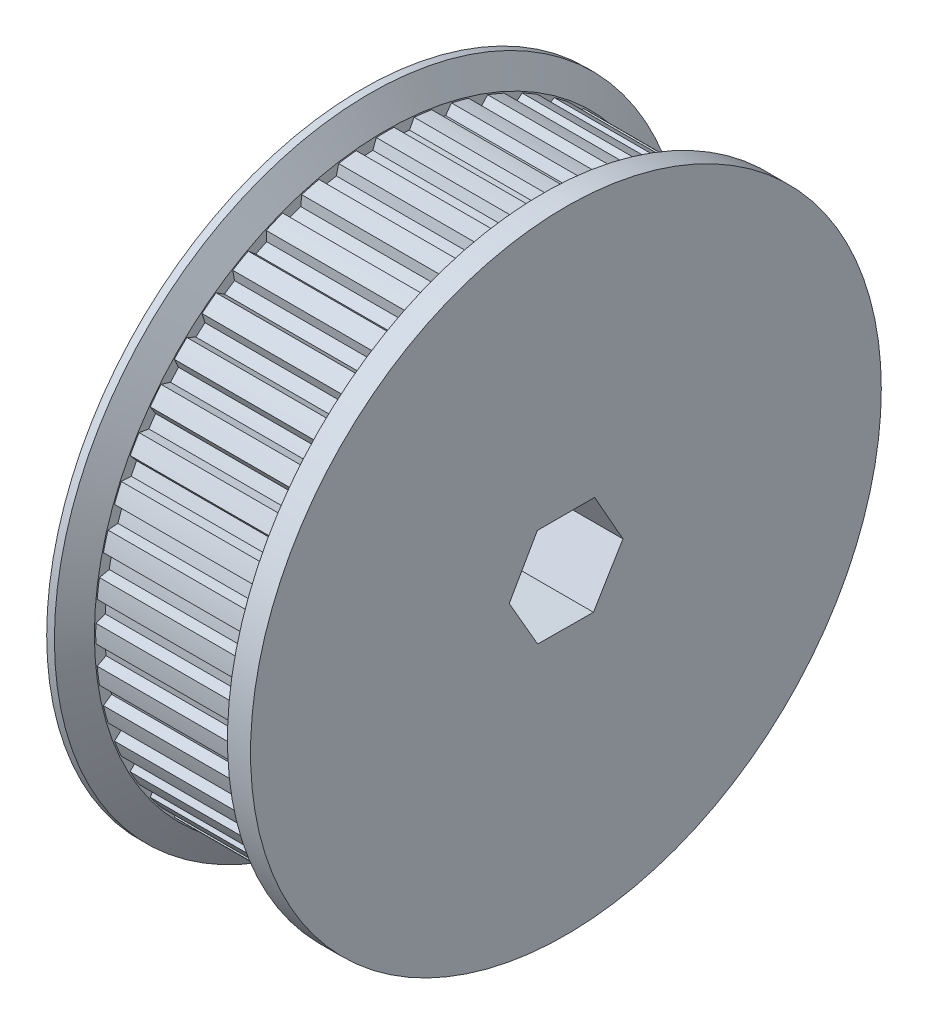
from build123d import *

# Parameters (mm, degrees)
SKETCH1_W                = 20.5
SKETCH1_H                = 37.625
CUT_EXTRUDE1_DEPTH       = 58.022199624
CUT_EXTRUDE2_DEPTH       = 58.022199624
CUT_EXTRUDE3_DEPTH       = 58.022199624
CUT_EXTRUDE4_DEPTH       = 58.022199624
CUT_EXTRUDE5_DEPTH       = 58.022199624
CUT_EXTRUDE6_DEPTH       = 58.022199624
CUT_EXTRUDE7_DEPTH       = 58.022199624
CUT_EXTRUDE8_DEPTH       = 58.022199624
CUT_EXTRUDE9_DEPTH       = 58.022199624
CUT_EXTRUDE10_DEPTH      = 58.022199624
CUT_EXTRUDE11_DEPTH      = 58.022199624
CUT_EXTRUDE12_DEPTH      = 58.022199624
CUT_EXTRUDE13_DEPTH      = 58.022199624
CUT_EXTRUDE14_DEPTH      = 58.022199624
CUT_EXTRUDE15_DEPTH      = 58.022199624
CUT_EXTRUDE16_DEPTH      = 58.022199624
CUT_EXTRUDE17_DEPTH      = 58.022199624
CUT_EXTRUDE18_DEPTH      = 58.022199624
CUT_EXTRUDE19_DEPTH      = 58.022199624
CUT_EXTRUDE20_DEPTH      = 58.022199624
CUT_EXTRUDE21_DEPTH      = 58.022199624
CUT_EXTRUDE22_DEPTH      = 58.022199624
CUT_EXTRUDE23_DEPTH      = 58.022199624
CUT_EXTRUDE24_DEPTH      = 58.022199624
CUT_EXTRUDE25_DEPTH      = 58.022199624
CUT_EXTRUDE26_DEPTH      = 58.022199624
CUT_EXTRUDE27_DEPTH      = 58.022199624
CUT_EXTRUDE28_DEPTH      = 58.022199624
CUT_EXTRUDE29_DEPTH      = 58.022199624
CUT_EXTRUDE30_DEPTH      = 58.022199624
CUT_EXTRUDE31_DEPTH      = 58.022199624
CUT_EXTRUDE32_DEPTH      = 58.022199624
CUT_EXTRUDE33_DEPTH      = 58.022199624
CUT_EXTRUDE34_DEPTH      = 58.022199624
CUT_EXTRUDE35_DEPTH      = 58.022199624
CUT_EXTRUDE36_DEPTH      = 58.022199624
CUT_EXTRUDE37_DEPTH      = 58.022199624
CUT_EXTRUDE38_DEPTH      = 58.022199624
CUT_EXTRUDE39_DEPTH      = 58.022199624
CUT_EXTRUDE40_DEPTH      = 58.022199624
CUT_EXTRUDE41_DEPTH      = 58.022199624
CUT_EXTRUDE42_DEPTH      = 58.022199624
CUT_EXTRUDE43_DEPTH      = 58.022199624
CUT_EXTRUDE44_DEPTH      = 58.022199624
CUT_EXTRUDE45_DEPTH      = 58.022199624
CUT_EXTRUDE46_DEPTH      = 58.022199624
CUT_EXTRUDE47_DEPTH      = 58.022199624
CUT_EXTRUDE48_DEPTH      = 58.022199624
SKETCH58_R               = 41
BOSS_EXTRUDE2_DEPTH      = 3
BOSS_EXTRUDE4_START      = 3
SKETCH60_R               = 41
BOSS_EXTRUDE4_DEPTH      = 3
CHAMFER1_SIZE            = 3.2
CHAMFER1_SIZE2           = 2
CUT_EXTRUDE49_DEPTH      = 63.563967266
CUT_EXTRUDE49_DEPTH_BACK = 63.563967266


with BuildPart() as part:
    # Sketch1 → Revolve1 (revolve)
    with BuildSketch(Plane(origin=(0, 0, 0), x_dir=(-1, 0, 0), z_dir=(0, 0, -1)), mode=Mode.PRIVATE) as revolve1_sk:
        with Locations((-10.25, 18.8125)):
            Rectangle(SKETCH1_W, SKETCH1_H)
    revolve(revolve1_sk.sketch.rotate(Axis((20.5, 0, 0), (-1, 0, 0)), 270), axis=Axis((20.5, 0, 0), (-1, 0, 0)))

    # Sketch2 → Cut-Extrude1 (cut, through all)
    with BuildSketch(Plane.ZY):
        with BuildLine():
            Line((-37.60720906, 1.156914747), (-36.389842333, 1.6))
            ThreePointArc((-36.389842333, 1.6), (-36.347011279, 2.382308982), (-36.287364095, 3.163515777))
            Line((-36.287364095, 3.163515777), (-37.43648185, 3.761708617))
            ThreePointArc((-37.43648185, 3.761708617), (-37.544441987, 2.460792737), (-37.60720906, 1.156914747))
        make_face()
    extrude(amount=-CUT_EXTRUDE1_DEPTH, mode=Mode.SUBTRACT)

    # Sketch3 → Cut-Extrude2 (cut, through all)
    with BuildSketch(Plane.ZY):
        with BuildLine():
            Line((-37.134466496, 6.05574298), (-35.869680279, 6.336139333))
            ThreePointArc((-35.869680279, 6.336139333), (-35.725103839, 7.106164979), (-35.563998996, 7.872902922))
            Line((-35.563998996, 7.872902922), (-36.625206056, 8.615968105))
            ThreePointArc((-36.625206056, 8.615968105), (-36.902046175, 7.340273366), (-37.134466496, 6.05574298))
        make_face()
    extrude(amount=-CUT_EXTRUDE2_DEPTH, mode=Mode.SUBTRACT)

    # Sketch4 → Cut-Extrude3 (cut, through all)
    with BuildSketch(Plane.ZY):
        with BuildLine():
            Line((-36.026342915, 10.850955771), (-34.735778052, 10.963865566))
            ThreePointArc((-34.735778052, 10.963865566), (-34.491929967, 11.708432524), (-34.232124014, 12.447582515))
            Line((-34.232124014, 12.447582515), (-35.187262832, 13.322805989))
            ThreePointArc((-35.187262832, 13.322805989), (-35.628246122, 12.094159882), (-36.026342915, 10.850955771))
        make_face()
    extrude(amount=-CUT_EXTRUDE3_DEPTH, mode=Mode.SUBTRACT)

    # Sketch5 → Cut-Extrude4 (cut, through all)
    with BuildSketch(Plane.ZY):
        with BuildLine():
            Line((-34.301798619, 15.4605057), (-33.007537031, 15.403997019))
            ThreePointArc((-33.007537031, 15.403997019), (-32.66858961, 16.110365541), (-32.3145279, 16.80928052))
            Line((-32.3145279, 16.80928052), (-33.147255785, 17.801686969))
            ThreePointArc((-33.147255785, 17.801686969), (-33.7448369, 16.641111969), (-34.301798619, 15.4605057))
        make_face()
    extrude(amount=-CUT_EXTRUDE4_DEPTH, mode=Mode.SUBTRACT)

    # Sketch6 → Cut-Extrude5 (cut, through all)
    with BuildSketch(Plane.ZY):
        with BuildLine():
            Line((-31.990341038, 19.805522091), (-30.7145279, 19.580561812))
            ThreePointArc((-30.7145279, 19.580561812), (-30.286280628, 20.236645738), (-29.844021254, 20.883367075))
            Line((-29.844021254, 20.883367075), (-30.540090001, 21.975976149))
            ThreePointArc((-30.540090001, 21.975976149), (-31.284044163, 20.903330017), (-31.990341038, 19.805522091))
        make_face()
    extrude(amount=-CUT_EXTRUDE5_DEPTH, mode=Mode.SUBTRACT)

    # Sketch7 → Cut-Extrude6 (cut, through all)
    with BuildSketch(Plane.ZY):
        with BuildLine():
            Line((-29.131519852, 23.811660507), (-27.895984681, 23.422097764))
            ThreePointArc((-27.895984681, 23.422097764), (-27.385764987, 24.016671315), (-26.86287513, 24.60013343))
            Line((-26.86287513, 24.60013343), (-27.410374811, 25.774250285))
            ThreePointArc((-27.410374811, 25.774250285), (-28.287972756, 24.807886293), (-29.131519852, 23.811660507))
        make_face()
    extrude(amount=-CUT_EXTRUDE6_DEPTH, mode=Mode.SUBTRACT)

    # Sketch8 → Cut-Extrude7 (cut, through all)
    with BuildSketch(Plane.ZY):
        with BuildLine():
            Line((-25.774250285, 27.410374811), (-24.60013343, 26.86287513))
            ThreePointArc((-24.60013343, 26.86287513), (-24.016671315, 27.385764987), (-23.422097764, 27.895984681))
            Line((-23.422097764, 27.895984681), (-23.811660507, 29.131519852))
            ThreePointArc((-23.811660507, 29.131519852), (-24.807886293, 28.287972756), (-25.774250285, 27.410374811))
        make_face()
    extrude(amount=-CUT_EXTRUDE7_DEPTH, mode=Mode.SUBTRACT)

    # Sketch9 → Cut-Extrude8 (cut, through all)
    with BuildSketch(Plane.ZY):
        with BuildLine():
            Line((-21.975976149, 30.540090001), (-20.883367075, 29.844021254))
            ThreePointArc((-20.883367075, 29.844021254), (-20.236645738, 30.286280628), (-19.580561812, 30.7145279))
            Line((-19.580561812, 30.7145279), (-19.805522091, 31.990341038))
            ThreePointArc((-19.805522091, 31.990341038), (-20.903330017, 31.284044163), (-21.975976149, 30.540090001))
        make_face()
    extrude(amount=-CUT_EXTRUDE8_DEPTH, mode=Mode.SUBTRACT)

    # Sketch10 → Cut-Extrude9 (cut, through all)
    with BuildSketch(Plane.ZY):
        with BuildLine():
            Line((-17.801686969, 33.147255785), (-16.80928052, 32.3145279))
            ThreePointArc((-16.80928052, 32.3145279), (-16.110365541, 32.66858961), (-15.403997019, 33.007537031))
            Line((-15.403997019, 33.007537031), (-15.4605057, 34.301798619))
            ThreePointArc((-15.4605057, 34.301798619), (-16.641111969, 33.7448369), (-17.801686969, 33.147255785))
        make_face()
    extrude(amount=-CUT_EXTRUDE9_DEPTH, mode=Mode.SUBTRACT)

    # Sketch11 → Cut-Extrude10 (cut, through all)
    with BuildSketch(Plane.ZY):
        with BuildLine():
            Line((-13.322805989, 35.187262832), (-12.447582515, 34.232124014))
            ThreePointArc((-12.447582515, 34.232124014), (-11.708432524, 34.491929967), (-10.963865566, 34.735778052))
            Line((-10.963865566, 34.735778052), (-10.850955771, 36.026342915))
            ThreePointArc((-10.850955771, 36.026342915), (-12.094159882, 35.628246122), (-13.322805989, 35.187262832))
        make_face()
    extrude(amount=-CUT_EXTRUDE10_DEPTH, mode=Mode.SUBTRACT)

    # Sketch12 → Cut-Extrude11 (cut, through all)
    with BuildSketch(Plane.ZY):
        with BuildLine():
            Line((-8.615968105, 36.625206056), (-7.872902922, 35.563998996))
            ThreePointArc((-7.872902922, 35.563998996), (-7.106164979, 35.725103839), (-6.336139333, 35.869680279))
            Line((-6.336139333, 35.869680279), (-6.05574298, 37.134466496))
            ThreePointArc((-6.05574298, 37.134466496), (-7.340273366, 36.902046175), (-8.615968105, 36.625206056))
        make_face()
    extrude(amount=-CUT_EXTRUDE11_DEPTH, mode=Mode.SUBTRACT)

    # Sketch13 → Cut-Extrude12 (cut, through all)
    with BuildSketch(Plane.ZY):
        with BuildLine():
            Line((-3.761708617, 37.43648185), (-3.163515777, 36.287364095))
            ThreePointArc((-3.163515777, 36.287364095), (-2.382308982, 36.347011279), (-1.6, 36.389842333))
            Line((-1.6, 36.389842333), (-1.156914747, 37.60720906))
            ThreePointArc((-1.156914747, 37.60720906), (-2.460792737, 37.544441987), (-3.761708617, 37.43648185))
        make_face()
    extrude(amount=-CUT_EXTRUDE12_DEPTH, mode=Mode.SUBTRACT)

    # Sketch14 → Cut-Extrude13 (cut, through all)
    with BuildSketch(Plane.ZY):
        with BuildLine():
            Line((1.156914747, 37.60720906), (1.6, 36.389842333))
            ThreePointArc((1.6, 36.389842333), (2.382308982, 36.347011279), (3.163515777, 36.287364095))
            Line((3.163515777, 36.287364095), (3.761708617, 37.43648185))
            ThreePointArc((3.761708617, 37.43648185), (2.460792737, 37.544441987), (1.156914747, 37.60720906))
        make_face()
    extrude(amount=-CUT_EXTRUDE13_DEPTH, mode=Mode.SUBTRACT)

    # Sketch15 → Cut-Extrude14 (cut, through all)
    with BuildSketch(Plane.ZY):
        with BuildLine():
            Line((6.05574298, 37.134466496), (6.336139333, 35.869680279))
            ThreePointArc((6.336139333, 35.869680279), (7.106164979, 35.725103839), (7.872902922, 35.563998996))
            Line((7.872902922, 35.563998996), (8.615968105, 36.625206056))
            ThreePointArc((8.615968105, 36.625206056), (7.340273366, 36.902046175), (6.05574298, 37.134466496))
        make_face()
    extrude(amount=-CUT_EXTRUDE14_DEPTH, mode=Mode.SUBTRACT)

    # Sketch16 → Cut-Extrude15 (cut, through all)
    with BuildSketch(Plane.ZY):
        with BuildLine():
            Line((10.850955771, 36.026342915), (10.963865566, 34.735778052))
            ThreePointArc((10.963865566, 34.735778052), (11.708432524, 34.491929967), (12.447582515, 34.232124014))
            Line((12.447582515, 34.232124014), (13.322805989, 35.187262832))
            ThreePointArc((13.322805989, 35.187262832), (12.094159882, 35.628246122), (10.850955771, 36.026342915))
        make_face()
    extrude(amount=-CUT_EXTRUDE15_DEPTH, mode=Mode.SUBTRACT)

    # Sketch17 → Cut-Extrude16 (cut, through all)
    with BuildSketch(Plane.ZY):
        with BuildLine():
            Line((15.4605057, 34.301798619), (15.403997019, 33.007537031))
            ThreePointArc((15.403997019, 33.007537031), (16.110365541, 32.66858961), (16.80928052, 32.3145279))
            Line((16.80928052, 32.3145279), (17.801686969, 33.147255785))
            ThreePointArc((17.801686969, 33.147255785), (16.641111969, 33.7448369), (15.4605057, 34.301798619))
        make_face()
    extrude(amount=-CUT_EXTRUDE16_DEPTH, mode=Mode.SUBTRACT)

    # Sketch18 → Cut-Extrude17 (cut, through all)
    with BuildSketch(Plane.ZY):
        with BuildLine():
            Line((19.805522091, 31.990341038), (19.580561812, 30.7145279))
            ThreePointArc((19.580561812, 30.7145279), (20.236645738, 30.286280628), (20.883367075, 29.844021254))
            Line((20.883367075, 29.844021254), (21.975976149, 30.540090001))
            ThreePointArc((21.975976149, 30.540090001), (20.903330017, 31.284044163), (19.805522091, 31.990341038))
        make_face()
    extrude(amount=-CUT_EXTRUDE17_DEPTH, mode=Mode.SUBTRACT)

    # Sketch19 → Cut-Extrude18 (cut, through all)
    with BuildSketch(Plane.ZY):
        with BuildLine():
            Line((23.811660507, 29.131519852), (23.422097764, 27.895984681))
            ThreePointArc((23.422097764, 27.895984681), (24.016671315, 27.385764987), (24.60013343, 26.86287513))
            Line((24.60013343, 26.86287513), (25.774250285, 27.410374811))
            ThreePointArc((25.774250285, 27.410374811), (24.807886293, 28.287972756), (23.811660507, 29.131519852))
        make_face()
    extrude(amount=-CUT_EXTRUDE18_DEPTH, mode=Mode.SUBTRACT)

    # Sketch20 → Cut-Extrude19 (cut, through all)
    with BuildSketch(Plane.ZY):
        with BuildLine():
            Line((27.410374811, 25.774250285), (26.86287513, 24.60013343))
            ThreePointArc((26.86287513, 24.60013343), (27.385764987, 24.016671315), (27.895984681, 23.422097764))
            Line((27.895984681, 23.422097764), (29.131519852, 23.811660507))
            ThreePointArc((29.131519852, 23.811660507), (28.287972756, 24.807886293), (27.410374811, 25.774250285))
        make_face()
    extrude(amount=-CUT_EXTRUDE19_DEPTH, mode=Mode.SUBTRACT)

    # Sketch21 → Cut-Extrude20 (cut, through all)
    with BuildSketch(Plane.ZY):
        with BuildLine():
            Line((30.540090001, 21.975976149), (29.844021254, 20.883367075))
            ThreePointArc((29.844021254, 20.883367075), (30.286280628, 20.236645738), (30.7145279, 19.580561812))
            Line((30.7145279, 19.580561812), (31.990341038, 19.805522091))
            ThreePointArc((31.990341038, 19.805522091), (31.284044163, 20.903330017), (30.540090001, 21.975976149))
        make_face()
    extrude(amount=-CUT_EXTRUDE20_DEPTH, mode=Mode.SUBTRACT)

    # Sketch22 → Cut-Extrude21 (cut, through all)
    with BuildSketch(Plane.ZY):
        with BuildLine():
            Line((33.147255785, 17.801686969), (32.3145279, 16.80928052))
            ThreePointArc((32.3145279, 16.80928052), (32.66858961, 16.110365541), (33.007537031, 15.403997019))
            Line((33.007537031, 15.403997019), (34.301798619, 15.4605057))
            ThreePointArc((34.301798619, 15.4605057), (33.7448369, 16.641111969), (33.147255785, 17.801686969))
        make_face()
    extrude(amount=-CUT_EXTRUDE21_DEPTH, mode=Mode.SUBTRACT)

    # Sketch23 → Cut-Extrude22 (cut, through all)
    with BuildSketch(Plane.ZY):
        with BuildLine():
            Line((35.187262832, 13.322805989), (34.232124014, 12.447582515))
            ThreePointArc((34.232124014, 12.447582515), (34.491929967, 11.708432524), (34.735778052, 10.963865566))
            Line((34.735778052, 10.963865566), (36.026342915, 10.850955771))
            ThreePointArc((36.026342915, 10.850955771), (35.628246122, 12.094159882), (35.187262832, 13.322805989))
        make_face()
    extrude(amount=-CUT_EXTRUDE22_DEPTH, mode=Mode.SUBTRACT)

    # Sketch24 → Cut-Extrude23 (cut, through all)
    with BuildSketch(Plane.ZY):
        with BuildLine():
            Line((36.625206056, 8.615968105), (35.563998996, 7.872902922))
            ThreePointArc((35.563998996, 7.872902922), (35.725103839, 7.106164979), (35.869680279, 6.336139333))
            Line((35.869680279, 6.336139333), (37.134466496, 6.05574298))
            ThreePointArc((37.134466496, 6.05574298), (36.902046175, 7.340273366), (36.625206056, 8.615968105))
        make_face()
    extrude(amount=-CUT_EXTRUDE23_DEPTH, mode=Mode.SUBTRACT)

    # Sketch25 → Cut-Extrude24 (cut, through all)
    with BuildSketch(Plane.ZY):
        with BuildLine():
            Line((37.43648185, 3.761708617), (36.287364095, 3.163515777))
            ThreePointArc((36.287364095, 3.163515777), (36.347011279, 2.382308982), (36.389842333, 1.6))
            Line((36.389842333, 1.6), (37.60720906, 1.156914747))
            ThreePointArc((37.60720906, 1.156914747), (37.544441987, 2.460792737), (37.43648185, 3.761708617))
        make_face()
    extrude(amount=-CUT_EXTRUDE24_DEPTH, mode=Mode.SUBTRACT)

    # Sketch26 → Cut-Extrude25 (cut, through all)
    with BuildSketch(Plane.ZY):
        with BuildLine():
            Line((37.60720906, -1.156914747), (36.389842333, -1.6))
            ThreePointArc((36.389842333, -1.6), (36.347011279, -2.382308982), (36.287364095, -3.163515777))
            Line((36.287364095, -3.163515777), (37.43648185, -3.761708617))
            ThreePointArc((37.43648185, -3.761708617), (37.544441987, -2.460792737), (37.60720906, -1.156914747))
        make_face()
    extrude(amount=-CUT_EXTRUDE25_DEPTH, mode=Mode.SUBTRACT)

    # Sketch27 → Cut-Extrude26 (cut, through all)
    with BuildSketch(Plane.ZY):
        with BuildLine():
            Line((37.134466496, -6.05574298), (35.869680279, -6.336139333))
            ThreePointArc((35.869680279, -6.336139333), (35.725103839, -7.106164979), (35.563998996, -7.872902922))
            Line((35.563998996, -7.872902922), (36.625206056, -8.615968105))
            ThreePointArc((36.625206056, -8.615968105), (36.902046175, -7.340273366), (37.134466496, -6.05574298))
        make_face()
    extrude(amount=-CUT_EXTRUDE26_DEPTH, mode=Mode.SUBTRACT)

    # Sketch28 → Cut-Extrude27 (cut, through all)
    with BuildSketch(Plane.ZY):
        with BuildLine():
            Line((36.026342915, -10.850955771), (34.735778052, -10.963865566))
            ThreePointArc((34.735778052, -10.963865566), (34.491929967, -11.708432524), (34.232124014, -12.447582515))
            Line((34.232124014, -12.447582515), (35.187262832, -13.322805989))
            ThreePointArc((35.187262832, -13.322805989), (35.628246122, -12.094159882), (36.026342915, -10.850955771))
        make_face()
    extrude(amount=-CUT_EXTRUDE27_DEPTH, mode=Mode.SUBTRACT)

    # Sketch29 → Cut-Extrude28 (cut, through all)
    with BuildSketch(Plane.ZY):
        with BuildLine():
            Line((34.301798619, -15.4605057), (33.007537031, -15.403997019))
            ThreePointArc((33.007537031, -15.403997019), (32.66858961, -16.110365541), (32.3145279, -16.80928052))
            Line((32.3145279, -16.80928052), (33.147255785, -17.801686969))
            ThreePointArc((33.147255785, -17.801686969), (33.7448369, -16.641111969), (34.301798619, -15.4605057))
        make_face()
    extrude(amount=-CUT_EXTRUDE28_DEPTH, mode=Mode.SUBTRACT)

    # Sketch30 → Cut-Extrude29 (cut, through all)
    with BuildSketch(Plane.ZY):
        with BuildLine():
            Line((31.990341038, -19.805522091), (30.7145279, -19.580561812))
            ThreePointArc((30.7145279, -19.580561812), (30.286280628, -20.236645738), (29.844021254, -20.883367075))
            Line((29.844021254, -20.883367075), (30.540090001, -21.975976149))
            ThreePointArc((30.540090001, -21.975976149), (31.284044163, -20.903330017), (31.990341038, -19.805522091))
        make_face()
    extrude(amount=-CUT_EXTRUDE29_DEPTH, mode=Mode.SUBTRACT)

    # Sketch31 → Cut-Extrude30 (cut, through all)
    with BuildSketch(Plane.ZY):
        with BuildLine():
            Line((29.131519852, -23.811660507), (27.895984681, -23.422097764))
            ThreePointArc((27.895984681, -23.422097764), (27.385764987, -24.016671315), (26.86287513, -24.60013343))
            Line((26.86287513, -24.60013343), (27.410374811, -25.774250285))
            ThreePointArc((27.410374811, -25.774250285), (28.287972756, -24.807886293), (29.131519852, -23.811660507))
        make_face()
    extrude(amount=-CUT_EXTRUDE30_DEPTH, mode=Mode.SUBTRACT)

    # Sketch32 → Cut-Extrude31 (cut, through all)
    with BuildSketch(Plane.ZY):
        with BuildLine():
            Line((25.774250285, -27.410374811), (24.60013343, -26.86287513))
            ThreePointArc((24.60013343, -26.86287513), (24.016671315, -27.385764987), (23.422097764, -27.895984681))
            Line((23.422097764, -27.895984681), (23.811660507, -29.131519852))
            ThreePointArc((23.811660507, -29.131519852), (24.807886293, -28.287972756), (25.774250285, -27.410374811))
        make_face()
    extrude(amount=-CUT_EXTRUDE31_DEPTH, mode=Mode.SUBTRACT)

    # Sketch33 → Cut-Extrude32 (cut, through all)
    with BuildSketch(Plane.ZY):
        with BuildLine():
            Line((21.975976149, -30.540090001), (20.883367075, -29.844021254))
            ThreePointArc((20.883367075, -29.844021254), (20.236645738, -30.286280628), (19.580561812, -30.7145279))
            Line((19.580561812, -30.7145279), (19.805522091, -31.990341038))
            ThreePointArc((19.805522091, -31.990341038), (20.903330017, -31.284044163), (21.975976149, -30.540090001))
        make_face()
    extrude(amount=-CUT_EXTRUDE32_DEPTH, mode=Mode.SUBTRACT)

    # Sketch34 → Cut-Extrude33 (cut, through all)
    with BuildSketch(Plane.ZY):
        with BuildLine():
            Line((17.801686969, -33.147255785), (16.80928052, -32.3145279))
            ThreePointArc((16.80928052, -32.3145279), (16.110365541, -32.66858961), (15.403997019, -33.007537031))
            Line((15.403997019, -33.007537031), (15.4605057, -34.301798619))
            ThreePointArc((15.4605057, -34.301798619), (16.641111969, -33.7448369), (17.801686969, -33.147255785))
        make_face()
    extrude(amount=-CUT_EXTRUDE33_DEPTH, mode=Mode.SUBTRACT)

    # Sketch35 → Cut-Extrude34 (cut, through all)
    with BuildSketch(Plane.ZY):
        with BuildLine():
            Line((13.322805989, -35.187262832), (12.447582515, -34.232124014))
            ThreePointArc((12.447582515, -34.232124014), (11.708432524, -34.491929967), (10.963865566, -34.735778052))
            Line((10.963865566, -34.735778052), (10.850955771, -36.026342915))
            ThreePointArc((10.850955771, -36.026342915), (12.094159882, -35.628246122), (13.322805989, -35.187262832))
        make_face()
    extrude(amount=-CUT_EXTRUDE34_DEPTH, mode=Mode.SUBTRACT)

    # Sketch36 → Cut-Extrude35 (cut, through all)
    with BuildSketch(Plane.ZY):
        with BuildLine():
            Line((8.615968105, -36.625206056), (7.872902922, -35.563998996))
            ThreePointArc((7.872902922, -35.563998996), (7.106164979, -35.725103839), (6.336139333, -35.869680279))
            Line((6.336139333, -35.869680279), (6.05574298, -37.134466496))
            ThreePointArc((6.05574298, -37.134466496), (7.340273366, -36.902046175), (8.615968105, -36.625206056))
        make_face()
    extrude(amount=-CUT_EXTRUDE35_DEPTH, mode=Mode.SUBTRACT)

    # Sketch37 → Cut-Extrude36 (cut, through all)
    with BuildSketch(Plane.ZY):
        with BuildLine():
            Line((3.761708617, -37.43648185), (3.163515777, -36.287364095))
            ThreePointArc((3.163515777, -36.287364095), (2.382308982, -36.347011279), (1.6, -36.389842333))
            Line((1.6, -36.389842333), (1.156914747, -37.60720906))
            ThreePointArc((1.156914747, -37.60720906), (2.460792737, -37.544441987), (3.761708617, -37.43648185))
        make_face()
    extrude(amount=-CUT_EXTRUDE36_DEPTH, mode=Mode.SUBTRACT)

    # Sketch38 → Cut-Extrude37 (cut, through all)
    with BuildSketch(Plane.ZY):
        with BuildLine():
            Line((-1.156914747, -37.60720906), (-1.6, -36.389842333))
            ThreePointArc((-1.6, -36.389842333), (-2.382308982, -36.347011279), (-3.163515777, -36.287364095))
            Line((-3.163515777, -36.287364095), (-3.761708617, -37.43648185))
            ThreePointArc((-3.761708617, -37.43648185), (-2.460792737, -37.544441987), (-1.156914747, -37.60720906))
        make_face()
    extrude(amount=-CUT_EXTRUDE37_DEPTH, mode=Mode.SUBTRACT)

    # Sketch39 → Cut-Extrude38 (cut, through all)
    with BuildSketch(Plane.ZY):
        with BuildLine():
            Line((-6.05574298, -37.134466496), (-6.336139333, -35.869680279))
            ThreePointArc((-6.336139333, -35.869680279), (-7.106164979, -35.725103839), (-7.872902922, -35.563998996))
            Line((-7.872902922, -35.563998996), (-8.615968105, -36.625206056))
            ThreePointArc((-8.615968105, -36.625206056), (-7.340273366, -36.902046175), (-6.05574298, -37.134466496))
        make_face()
    extrude(amount=-CUT_EXTRUDE38_DEPTH, mode=Mode.SUBTRACT)

    # Sketch40 → Cut-Extrude39 (cut, through all)
    with BuildSketch(Plane.ZY):
        with BuildLine():
            Line((-10.850955771, -36.026342915), (-10.963865566, -34.735778052))
            ThreePointArc((-10.963865566, -34.735778052), (-11.708432524, -34.491929967), (-12.447582515, -34.232124014))
            Line((-12.447582515, -34.232124014), (-13.322805989, -35.187262832))
            ThreePointArc((-13.322805989, -35.187262832), (-12.094159882, -35.628246122), (-10.850955771, -36.026342915))
        make_face()
    extrude(amount=-CUT_EXTRUDE39_DEPTH, mode=Mode.SUBTRACT)

    # Sketch41 → Cut-Extrude40 (cut, through all)
    with BuildSketch(Plane.ZY):
        with BuildLine():
            Line((-15.4605057, -34.301798619), (-15.403997019, -33.007537031))
            ThreePointArc((-15.403997019, -33.007537031), (-16.110365541, -32.66858961), (-16.80928052, -32.3145279))
            Line((-16.80928052, -32.3145279), (-17.801686969, -33.147255785))
            ThreePointArc((-17.801686969, -33.147255785), (-16.641111969, -33.7448369), (-15.4605057, -34.301798619))
        make_face()
    extrude(amount=-CUT_EXTRUDE40_DEPTH, mode=Mode.SUBTRACT)

    # Sketch42 → Cut-Extrude41 (cut, through all)
    with BuildSketch(Plane.ZY):
        with BuildLine():
            Line((-19.805522091, -31.990341038), (-19.580561812, -30.7145279))
            ThreePointArc((-19.580561812, -30.7145279), (-20.236645738, -30.286280628), (-20.883367075, -29.844021254))
            Line((-20.883367075, -29.844021254), (-21.975976149, -30.540090001))
            ThreePointArc((-21.975976149, -30.540090001), (-20.903330017, -31.284044163), (-19.805522091, -31.990341038))
        make_face()
    extrude(amount=-CUT_EXTRUDE41_DEPTH, mode=Mode.SUBTRACT)

    # Sketch43 → Cut-Extrude42 (cut, through all)
    with BuildSketch(Plane.ZY):
        with BuildLine():
            Line((-23.811660507, -29.131519852), (-23.422097764, -27.895984681))
            ThreePointArc((-23.422097764, -27.895984681), (-24.016671315, -27.385764987), (-24.60013343, -26.86287513))
            Line((-24.60013343, -26.86287513), (-25.774250285, -27.410374811))
            ThreePointArc((-25.774250285, -27.410374811), (-24.807886293, -28.287972756), (-23.811660507, -29.131519852))
        make_face()
    extrude(amount=-CUT_EXTRUDE42_DEPTH, mode=Mode.SUBTRACT)

    # Sketch44 → Cut-Extrude43 (cut, through all)
    with BuildSketch(Plane.ZY):
        with BuildLine():
            Line((-27.410374811, -25.774250285), (-26.86287513, -24.60013343))
            ThreePointArc((-26.86287513, -24.60013343), (-27.385764987, -24.016671315), (-27.895984681, -23.422097764))
            Line((-27.895984681, -23.422097764), (-29.131519852, -23.811660507))
            ThreePointArc((-29.131519852, -23.811660507), (-28.287972756, -24.807886293), (-27.410374811, -25.774250285))
        make_face()
    extrude(amount=-CUT_EXTRUDE43_DEPTH, mode=Mode.SUBTRACT)

    # Sketch45 → Cut-Extrude44 (cut, through all)
    with BuildSketch(Plane.ZY):
        with BuildLine():
            Line((-30.540090001, -21.975976149), (-29.844021254, -20.883367075))
            ThreePointArc((-29.844021254, -20.883367075), (-30.286280628, -20.236645738), (-30.7145279, -19.580561812))
            Line((-30.7145279, -19.580561812), (-31.990341038, -19.805522091))
            ThreePointArc((-31.990341038, -19.805522091), (-31.284044163, -20.903330017), (-30.540090001, -21.975976149))
        make_face()
    extrude(amount=-CUT_EXTRUDE44_DEPTH, mode=Mode.SUBTRACT)

    # Sketch46 → Cut-Extrude45 (cut, through all)
    with BuildSketch(Plane.ZY):
        with BuildLine():
            Line((-33.147255785, -17.801686969), (-32.3145279, -16.80928052))
            ThreePointArc((-32.3145279, -16.80928052), (-32.66858961, -16.110365541), (-33.007537031, -15.403997019))
            Line((-33.007537031, -15.403997019), (-34.301798619, -15.4605057))
            ThreePointArc((-34.301798619, -15.4605057), (-33.7448369, -16.641111969), (-33.147255785, -17.801686969))
        make_face()
    extrude(amount=-CUT_EXTRUDE45_DEPTH, mode=Mode.SUBTRACT)

    # Sketch47 → Cut-Extrude46 (cut, through all)
    with BuildSketch(Plane.ZY):
        with BuildLine():
            Line((-35.187262832, -13.322805989), (-34.232124014, -12.447582515))
            ThreePointArc((-34.232124014, -12.447582515), (-34.491929967, -11.708432524), (-34.735778052, -10.963865566))
            Line((-34.735778052, -10.963865566), (-36.026342915, -10.850955771))
            ThreePointArc((-36.026342915, -10.850955771), (-35.628246122, -12.094159882), (-35.187262832, -13.322805989))
        make_face()
    extrude(amount=-CUT_EXTRUDE46_DEPTH, mode=Mode.SUBTRACT)

    # Sketch48 → Cut-Extrude47 (cut, through all)
    with BuildSketch(Plane.ZY):
        with BuildLine():
            Line((-36.625206056, -8.615968105), (-35.563998996, -7.872902922))
            ThreePointArc((-35.563998996, -7.872902922), (-35.725103839, -7.106164979), (-35.869680279, -6.336139333))
            Line((-35.869680279, -6.336139333), (-37.134466496, -6.05574298))
            ThreePointArc((-37.134466496, -6.05574298), (-36.902046175, -7.340273366), (-36.625206056, -8.615968105))
        make_face()
    extrude(amount=-CUT_EXTRUDE47_DEPTH, mode=Mode.SUBTRACT)

    # Sketch49 → Cut-Extrude48 (cut, through all)
    with BuildSketch(Plane.ZY):
        with BuildLine():
            Line((-37.43648185, -3.761708617), (-36.287364095, -3.163515777))
            ThreePointArc((-36.287364095, -3.163515777), (-36.347011279, -2.382308982), (-36.389842333, -1.6))
            Line((-36.389842333, -1.6), (-37.60720906, -1.156914747))
            ThreePointArc((-37.60720906, -1.156914747), (-37.544441987, -2.460792737), (-37.43648185, -3.761708617))
        make_face()
    extrude(amount=-CUT_EXTRUDE48_DEPTH, mode=Mode.SUBTRACT)

    # Sketch58 → Boss-Extrude2 (add)
    with BuildSketch(Plane(origin=(20.5, 0, 0), x_dir=(0, 0, -1), z_dir=(1, 0, 0))):
        Circle(SKETCH58_R)
    extrude(amount=BOSS_EXTRUDE2_DEPTH)

    # Sketch60 → Boss-Extrude4 (add)
    with BuildSketch(Plane.ZY.offset(BOSS_EXTRUDE4_START)):
        with Locations(Location((0, 0, 0), (0, 0, 180))):
            Circle(SKETCH60_R)
    extrude(amount=-BOSS_EXTRUDE4_DEPTH)

    # Chamfer1
    chamfer1_edges = [part.edges().sort_by_distance(p)[0] for p in [
        (0, 0, 41),
    ]]
    chamfer1_side = [part.faces().sort_by_distance(p)[0] for p in [
        (0, 0, 39.840344879),
    ]]
    chamfer(chamfer1_edges, length=CHAMFER1_SIZE, length2=CHAMFER1_SIZE2, reference=chamfer1_side[0])

    # Sketch54 → Cut-Extrude49 (cut, two sides: drawn at the far end of the back side and taken through both)
    with BuildSketch(Plane(origin=(0, 0, 0), x_dir=(0, 0, -1), z_dir=(1, 0, 0)).offset(-CUT_EXTRUDE49_DEPTH_BACK)):
        Polygon((-3.716057782, 6.4008), (-7.370453027, 0), (-3.674834463, -6.4008), (3.581785529, -6.45337831), (7.410944665, -0.10717391), (3.736756138, 6.4008), align=None)
    extrude(amount=CUT_EXTRUDE49_DEPTH + CUT_EXTRUDE49_DEPTH_BACK, mode=Mode.SUBTRACT)


solid = part.part
